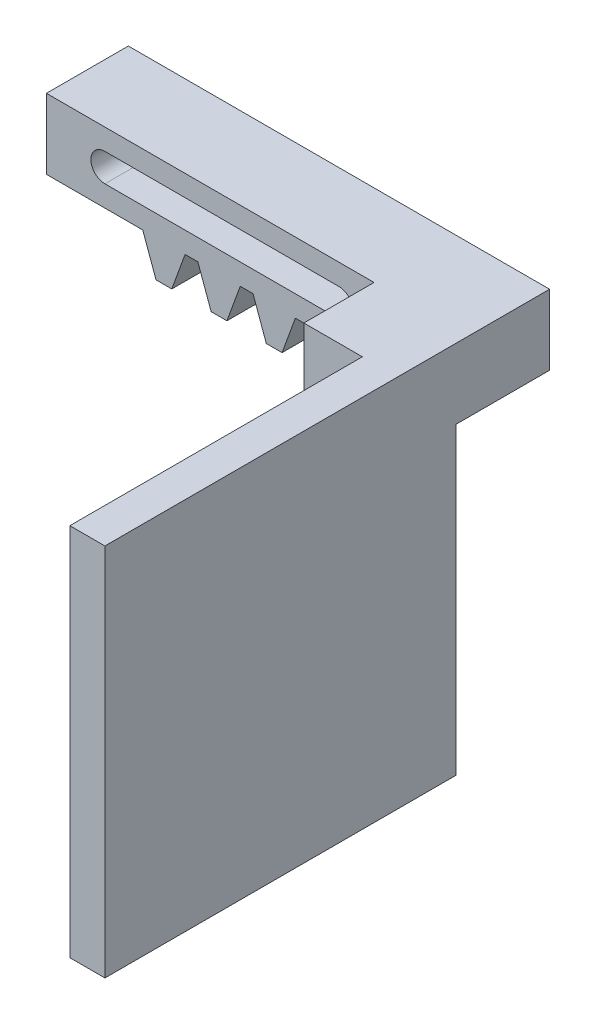
from build123d import *

# Parameters (mm, degrees)
BOSS_EXTRUDE1_START     = 13.5
BOSS_EXTRUDE1_DEPTH     = 7
BOSS_EXTRUDE2_START     = 20.5
SKETCH2_W               = 8
SKETCH2_H               = 6
BOSS_EXTRUDE2_DEPTH     = 6
BOSS_EXTRUDE3_START     = 21.5
SKETCH3_W               = 3
SKETCH3_H               = 31.975
BOSS_EXTRUDE3_DEPTH     = 30
CUT_EXTRUDE1_DEPTH      = 60.835195537
CUT_EXTRUDE1_DEPTH_BACK = 60.835195537
SKETCH4_W               = 20
SKETCH4_H               = 2.4
CUT_EXTRUDE2_DEPTH      = 60.835195537
CUT_EXTRUDE2_DEPTH_BACK = 60.835195537
SKETCH5_R               = 1.2


with BuildPart() as part:
    # Sketch1 → Boss-Extrude1 (new body)
    with BuildSketch(Plane.XY.offset(BOSS_EXTRUDE1_START)):
        Polygon((-23, 19.975), (13, 19.975), (13, 13.975), (7.70102766, 13.975), (6.563620678, 10.85), (5.217351773, 10.85), (4.079944791, 13.975), (2.988638679, 13.975), (1.851231697, 10.85), (0.504962793, 10.85), (-0.632444189, 13.975), (-1.723750301, 13.975), (-2.861157283, 10.85), (-4.207426188, 10.85), (-5.34483317, 13.975), (-6.436139281, 13.975), (-7.573546263, 10.85), (-8.919815168, 10.85), (-10.05722215, 13.975), (-11.148528262, 13.975), (-12.285935244, 10.85), (-13.632204148, 10.85), (-14.76961113, 13.975), (-23, 13.975), align=None)
    extrude(amount=BOSS_EXTRUDE1_DEPTH)

    # Sketch2 → Boss-Extrude2 (add)
    with BuildSketch(Plane.XY.offset(BOSS_EXTRUDE2_START)):
        with Locations((9, 16.975)):
            Rectangle(SKETCH2_W, SKETCH2_H)
    extrude(amount=BOSS_EXTRUDE2_DEPTH)

    # Sketch3 → Boss-Extrude3 (add)
    with BuildSketch(Plane.XY.offset(BOSS_EXTRUDE3_START)):
        with Locations((11.5, 3.9875)):
            Rectangle(SKETCH3_W, SKETCH3_H)
    extrude(amount=BOSS_EXTRUDE3_DEPTH)

    # Sketch4 → Cut-Extrude1 (cut, two sides: drawn at the far end of the back side and taken through both)
    with BuildSketch(Plane.XY.offset(-CUT_EXTRUDE1_DEPTH_BACK)):
        with Locations((-8, 16.975)):
            Rectangle(SKETCH4_W, SKETCH4_H)
    extrude(amount=CUT_EXTRUDE1_DEPTH + CUT_EXTRUDE1_DEPTH_BACK, mode=Mode.SUBTRACT)

    # Sketch5 → Cut-Extrude2 (cut, two sides: drawn at the far end of the back side and taken through both)
    with BuildSketch(Plane.XY.offset(-CUT_EXTRUDE2_DEPTH_BACK)):
        with Locations((-18, 16.975)):
            Circle(SKETCH5_R)
        with Locations((2, 16.975)):
            Circle(SKETCH5_R)
    extrude(amount=CUT_EXTRUDE2_DEPTH + CUT_EXTRUDE2_DEPTH_BACK, mode=Mode.SUBTRACT)


solid = part.part
